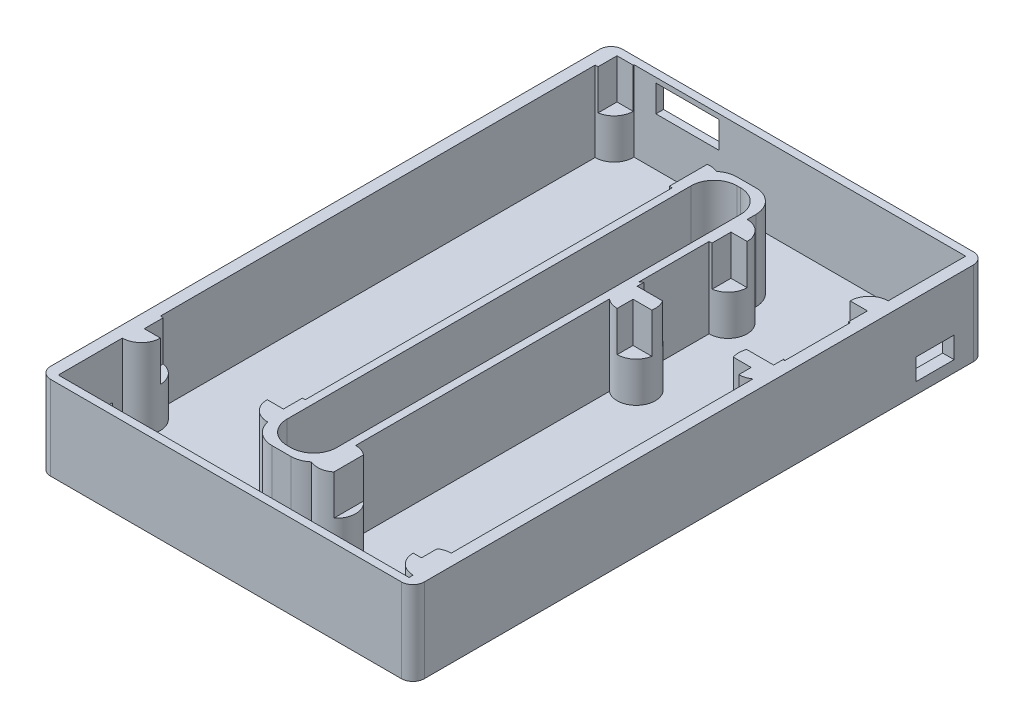
from build123d import *

# Parameters (mm, degrees)
BOSS_EXTRUDE1_DEPTH = 11
SKETCH8_W           = 46
SKETCH8_H           = 73
CUT_EXTRUDE1_DEPTH  = 10.5
BOSS_EXTRUDE2_START = 10.5
SKETCH9_R           = 2.5
BOSS_EXTRUDE2_DEPTH = 10.5
SKETCH10_W          = 15.5
SKETCH10_H          = 43.25
SKETCH10_W_2        = 17.9
SKETCH10_H_2        = 12.3
SKETCH10_W_3        = 18.25
SKETCH10_H_3        = 62
CUT_EXTRUDE3_DEPTH  = 5.25
SKETCH11_W          = 5
SKETCH11_H          = 2.8
CUT_EXTRUDE4_DEPTH  = 5
SKETCH12_W          = 5
SKETCH12_H          = 2.8
CUT_EXTRUDE5_DEPTH  = 5
SKETCH14_W          = 8.25
SKETCH14_H          = 3.5
CUT_EXTRUDE6_DEPTH  = 5


with BuildPart() as part:
    # Sketch2 → Boss-Extrude1 (new body)
    with BuildSketch(Plane(origin=(0, 0, 0), x_dir=(1, 0, 0), z_dir=(0, 1, 0))):
        with BuildLine():
            Line((23, -37.5), (-23, -37.5))
            ThreePointArc((-23, -37.5), (-24.060660172, -37.060660172), (-24.5, -36))
            Line((-24.5, -36), (-24.5, 36))
            ThreePointArc((-24.5, 36), (-24.060660172, 37.060660172), (-23, 37.5))
            Line((-23, 37.5), (23, 37.5))
            ThreePointArc((23, 37.5), (24.060660172, 37.060660172), (24.5, 36))
            Line((24.5, 36), (24.5, -36))
            ThreePointArc((24.5, -36), (24.060660172, -37.060660172), (23, -37.5))
        make_face()
        with BuildLine():
            Line((0, 29.5), (0.5, 29.5))
            ThreePointArc((0.5, 29.5), (2.621320344, 28.621320344), (3.5, 26.5))
            Line((3.5, 26.5), (3.5, -26.5))
            ThreePointArc((3.5, -26.5), (2.621320344, -28.621320344), (0.5, -29.5))
            Line((0.5, -29.5), (0, -29.5))
            ThreePointArc((0, -29.5), (-2.121320344, -28.621320344), (-3, -26.5))
            Line((-3, -26.5), (-3, 26.5))
            ThreePointArc((-3, 26.5), (-2.121320344, 28.621320344), (0, 29.5))
        make_face(mode=Mode.SUBTRACT)
    extrude(amount=-BOSS_EXTRUDE1_DEPTH)

    # Sketch8 → Cut-Extrude1 (cut)
    # profile 1 of 2: a face of its own
    with BuildSketch(Plane(origin=(0, 0, 0), x_dir=(1, 0, 0), z_dir=(0, 1, 0))):
        Rectangle(SKETCH8_W, SKETCH8_H)
        with BuildLine():
            Line((-1, 30.5), (1.5, 30.5))
            ThreePointArc((1.5, 30.5), (3.621320344, 29.621320344), (4.5, 27.5))
            Line((4.5, 27.5), (4.5, -27.5))
            ThreePointArc((4.5, -27.5), (3.621320344, -29.621320344), (1.5, -30.5))
            Line((1.5, -30.5), (-1, -30.5))
            ThreePointArc((-1, -30.5), (-3.121320344, -29.621320344), (-4, -27.5))
            Line((-4, -27.5), (-4, 27.5))
            ThreePointArc((-4, 27.5), (-3.121320344, 29.621320344), (-1, 30.5))
        make_face(mode=Mode.SUBTRACT)
    # profile 2 of 2: a face of its own
    with BuildSketch(Plane(origin=(0, 0, 0), x_dir=(1, 0, 0), z_dir=(0, 1, 0))):
        with BuildLine():
            Line((0, 29.5), (0.5, 29.5))
            ThreePointArc((0.5, 29.5), (2.621320344, 28.621320344), (3.5, 26.5))
            Line((3.5, 26.5), (3.5, -26.5))
            ThreePointArc((3.5, -26.5), (2.621320344, -28.621320344), (0.5, -29.5))
            Line((0.5, -29.5), (0, -29.5))
            ThreePointArc((0, -29.5), (-2.121320344, -28.621320344), (-3, -26.5))
            Line((-3, -26.5), (-3, 26.5))
            ThreePointArc((-3, 26.5), (-2.121320344, 28.621320344), (0, 29.5))
        make_face()
    extrude(amount=-CUT_EXTRUDE1_DEPTH, mode=Mode.SUBTRACT)

    # Sketch9 → Boss-Extrude2 (add)
    with BuildSketch(Plane(origin=(0, -10.5, 0), x_dir=(1, 0, 0), z_dir=(0, 1, 0)).offset(BOSS_EXTRUDE2_START)):
        with Locations((21.58, 10.667919779)):
            Circle(SKETCH9_R)
        with Locations((6.08, 10.21529089)):
            Circle(SKETCH9_R)
        with BuildLine():
            Line((24.5, -35.456747529), (24.5, -31.456747529))
            ThreePointArc((24.5, -31.456747529), (20.5, -33.456747529), (24.5, -35.456747529))
        make_face()
        with BuildLine():
            Line((4.5, 26.342587088), (4.5, 21.342587088))
            ThreePointArc((4.5, 21.342587088), (7, 23.842587088), (4.5, 26.342587088))
        make_face()
        with BuildLine():
            Line((-4, 27.5), (-4, 25))
            ThreePointArc((-4, 25), (-6.442500859, 28.033094319), (-2.958333333, 29.772648357))
            ThreePointArc((-2.958333333, 29.772648357), (-3.727178029, 28.75), (-4, 27.5))
        make_face()
        with BuildLine():
            Line((-24.5, -27.605307327), (-24.5, -23.605307327))
            ThreePointArc((-24.5, -23.605307327), (-20.5, -25.605307327), (-24.5, -27.605307327))
        make_face()
        with BuildLine():
            Line((-20.757613835, 37.5), (-23, 37.5))
            ThreePointArc((-23, 37.5), (-24.060660172, 37.060660172), (-24.5, 36))
            Line((-24.5, 36), (-24.5, 34.394692673))
            ThreePointArc((-24.5, 34.394692673), (-21.40359225, 34.470769001), (-20.757613835, 37.5))
        make_face()
        with BuildLine():
            Line((24.5, 21.842587088), (24.5, 25.842587088))
            ThreePointArc((24.5, 25.842587088), (20.5, 23.842587088), (24.5, 21.842587088))
        make_face()
        with BuildLine():
            Line((-4, -23.105307327), (-4, -27.5))
            ThreePointArc((-4, -27.5), (-3.984574172, -27.803837144), (-3.938455326, -28.104549663))
            ThreePointArc((-3.938455326, -28.104549663), (-6.499810577, -25.636081995), (-4, -23.105307327))
        make_face()
        with BuildLine():
            Line((4.5, -25), (4.5, -27.5))
            ThreePointArc((4.5, -27.5), (4.227178029, -28.75), (3.458333333, -29.772648357))
            ThreePointArc((3.458333333, -29.772648357), (6.942500859, -28.033094319), (4.5, -25))
        make_face()
    extrude(amount=-BOSS_EXTRUDE2_DEPTH)

    # Sketch10 → Cut-Extrude3 (cut)
    with BuildSketch(Plane(origin=(0, -5.25, 0), x_dir=(1, 0, 0), z_dir=(0, 1, 0))):
        with Locations((13.83, -11.831747529)):
            Rectangle(SKETCH10_W, SKETCH10_H)
        with Locations((13.825, 17.692587088)):
            Rectangle(SKETCH10_W_2, SKETCH10_H_2)
        with Locations((-13.5, 5.394692673)):
            Rectangle(SKETCH10_W_3, SKETCH10_H_3)
    extrude(amount=CUT_EXTRUDE3_DEPTH, mode=Mode.SUBTRACT)

    # Sketch11 → Cut-Extrude4 (cut)
    with BuildSketch(Plane.ZY.offset(-23)):
        with Locations((-30.985, -8.1)):
            Rectangle(SKETCH11_W, SKETCH11_H)
    extrude(amount=-CUT_EXTRUDE4_DEPTH, mode=Mode.SUBTRACT)

    # Sketch12 → Cut-Extrude5 (cut)
    with BuildSketch(Plane(origin=(-23, 0, 0), x_dir=(0, 0, -1), z_dir=(1, 0, 0))):
        with Locations((-31.89, -8.1)):
            Rectangle(SKETCH12_W, SKETCH12_H)
    extrude(amount=-CUT_EXTRUDE5_DEPTH, mode=Mode.SUBTRACT)

    # Sketch14 → Cut-Extrude6 (cut)
    with BuildSketch(Plane.XY.offset(-36.5)):
        with Locations((-13.5, -2.4)):
            Rectangle(SKETCH14_W, SKETCH14_H)
    extrude(amount=-CUT_EXTRUDE6_DEPTH, mode=Mode.SUBTRACT)


solid = part.part
